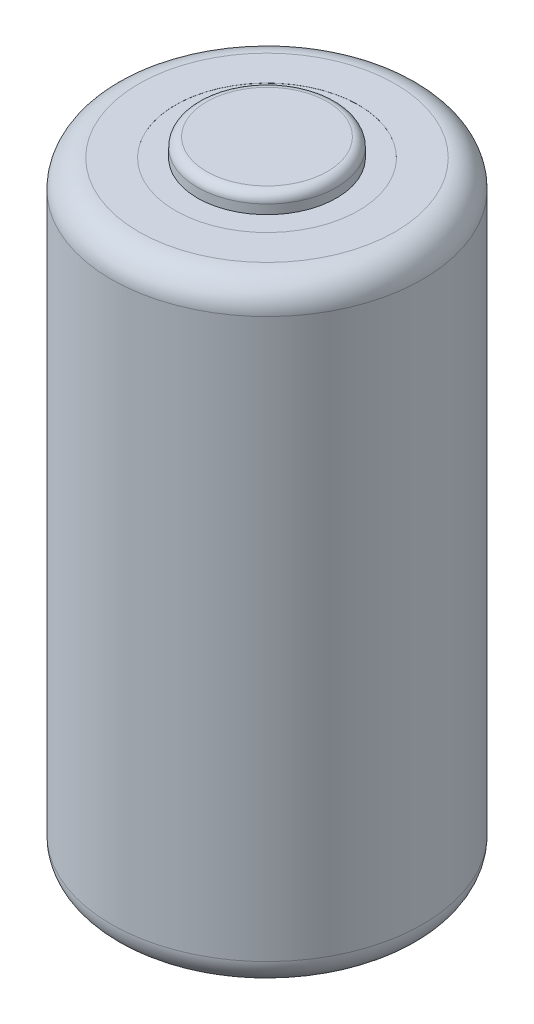
from build123d import *

# Parameters (mm, degrees)
SKIZZE1_R                       = 8.5
AUFSATZ_LINEAR_AUSTRAGEN1_DEPTH = 33.5
SKIZZE2_R                       = 3.799988553
AUFSATZ_LINEAR_AUSTRAGEN2_DEPTH = 1
VERRUNDUNG1_R                   = 1.5
VERRUNDUNG2_R                   = 0.5
SCHNITT_LINEAR_START            = -0.005
SKIZZE3_R                       = 5
SKIZZE3_R_2                     = 3.799988553
SCHNITT_LINEAR_AUSTRAGEN1_DEPTH = 0.005


with BuildPart() as part:
    # Skizze1 → Aufsatz-Linear austragen1 (new body)
    with BuildSketch(Plane(origin=(0, 0, 0), x_dir=(1, 0, 0), z_dir=(0, 1, 0))):
        with Locations(Location((0, 0, 0), (0, 0, 270))):
            Circle(SKIZZE1_R)
    extrude(amount=AUFSATZ_LINEAR_AUSTRAGEN1_DEPTH)

    # Skizze2 → Aufsatz-Linear austragen2 (add)
    with BuildSketch(Plane(origin=(0, 33.5, 0), x_dir=(1, 0, 0), z_dir=(0, 1, 0))):
        with Locations(Location((0, 0, 0), (0, 0, 270))):
            Circle(SKIZZE2_R)
    extrude(amount=AUFSATZ_LINEAR_AUSTRAGEN2_DEPTH)

    # Verrundung1
    verrundung1_edges = [part.edges().sort_by_distance(p)[0] for p in [
        (0, 0, -8.5),
        (0, 33.5, -8.5),
    ]]
    fillet(verrundung1_edges, radius=VERRUNDUNG1_R)

    # Verrundung2
    verrundung2_edges = [part.edges().sort_by_distance(p)[0] for p in [
        (0, 34.5, -3.799988553),
    ]]
    fillet(verrundung2_edges, radius=VERRUNDUNG2_R)

    # Skizze3 → Schnitt-Linear austragen1 (cut)
    with BuildSketch(Plane(origin=(0, 33.5, 0), x_dir=(1, 0, 0), z_dir=(0, 1, 0)).offset(SCHNITT_LINEAR_START)):
        with Locations(Location((0, 0, 0), (0, 0, 270))):
            Circle(SKIZZE3_R)
        with Locations(Location((0, 0, 0), (0, 0, 270))):
            Circle(SKIZZE3_R_2, mode=Mode.SUBTRACT)
    extrude(amount=SCHNITT_LINEAR_AUSTRAGEN1_DEPTH, mode=Mode.SUBTRACT)


solid = part.part
